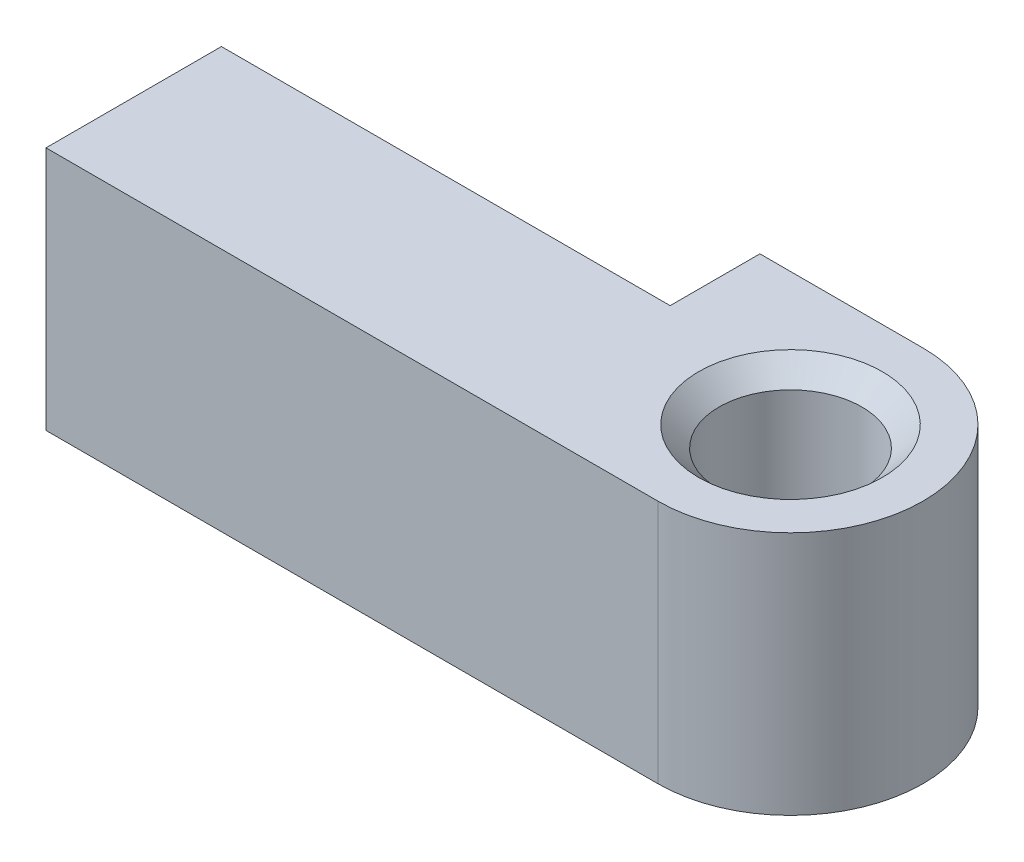
from build123d import *

# Parameters (mm, degrees)
SKETCH2_R           = 1.75
BOSS_EXTRUDE1_DEPTH = 6
CHAMFER1_SIZE       = 0.5


with BuildPart() as part:
    # Sketch2 → Boss-Extrude1 (new body)
    with BuildSketch(Plane(origin=(0, 0, 0), x_dir=(1, 0, 0), z_dir=(0, 1, 0))):
        with BuildLine():
            Line((11, 2.2), (15, 2.2))
            ThreePointArc((15, 2.2), (18.25, -1.05), (15, -4.3))
            Line((15, -4.3), (0, -4.3))
            Line((0, -4.3), (0, 0))
            Line((0, 0), (11, 0))
            Line((11, 0), (11, 2.2))
        make_face()
        with Locations(Location((15, -1.05, 0), (0, 0, 270))):
            Circle(SKETCH2_R, mode=Mode.SUBTRACT)
    extrude(amount=BOSS_EXTRUDE1_DEPTH)

    # Chamfer1
    chamfer1_edges = [part.edges().sort_by_distance(p)[0] for p in [
        (15, 6, -0.7),
    ]]
    chamfer(chamfer1_edges, length=CHAMFER1_SIZE)


solid = part.part
